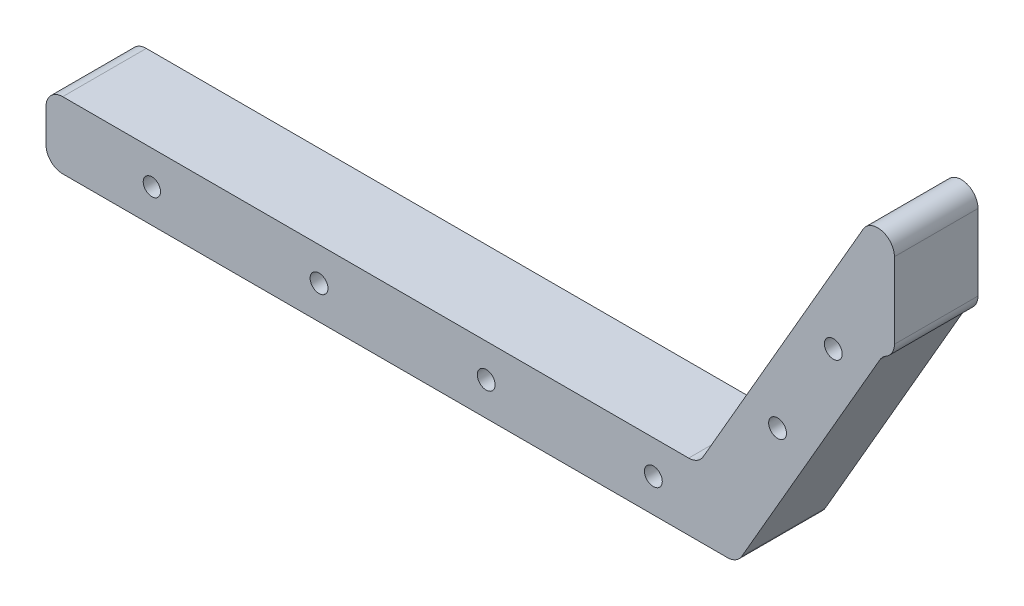
from build123d import *

# Parameters (mm, degrees)
SKETCH_2_R      = 1.6
EXTRUDE_1_DEPTH = 15
FILLET_1_R      = 3
SKETCH_3_W      = 45
SKETCH_3_H      = 12
SKETCH_3_R      = 1.55
EXTRUDE_2_DEPTH = 15
FILLET_2_R      = 3


with BuildPart() as part:
    # 草图2 → 凸台-拉伸1 (new body)
    with BuildSketch(Plane.XY):
        with BuildLine():
            Line((110.262395693, 45.951905284), (110.262395693, 72.951905284))
            Line((110.262395693, 72.951905284), (75.937822174, 13.5))
            ThreePointArc((75.937822174, 13.5), (74.839745962, 12.401923789), (73.339745962, 12))
            Line((73.339745962, 12), (0, 12))
            Line((0, 12), (0, 0))
            Line((0, 0), (80.267949192, 0))
            ThreePointArc((80.267949192, 0), (81.767949192, 0.401923789), (82.866025404, 1.5))
            Line((82.866025404, 1.5), (107.664319482, 44.451905284))
            ThreePointArc((107.664319482, 44.451905284), (108.762395693, 45.549981495), (110.262395693, 45.951905284))
        make_face()
        with Locations((99.292740578, 41.951905284)):
            Circle(SKETCH_2_R, mode=Mode.SUBTRACT)
        with Locations((89.292740578, 24.631397208)):
            Circle(SKETCH_2_R, mode=Mode.SUBTRACT)
        with Locations((67, 6)):
            Circle(SKETCH_2_R, mode=Mode.SUBTRACT)
        with Locations((37, 6)):
            Circle(SKETCH_2_R, mode=Mode.SUBTRACT)
        with Locations((7, 6)):
            Circle(SKETCH_2_R, mode=Mode.SUBTRACT)
    extrude(amount=EXTRUDE_1_DEPTH)

    # 圆角1
    fillet_1_edges = [part.edges().sort_by_distance(p)[0] for p in [
        (0, 0, 7.5),
        (0, 12, 7.5),
        (110.262395693, 72.951905284, 7.5),
        (110.262395693, 45.951905284, 7.5),
    ]]
    fillet(fillet_1_edges, radius=FILLET_1_R)

    # 草图3 → 凸台-拉伸2 (add)
    with BuildSketch(Plane.XY.offset(15)):
        with Locations((-19.5, 6)):
            Rectangle(SKETCH_3_W, SKETCH_3_H)
        with Locations((-23, 6)):
            Circle(SKETCH_3_R, mode=Mode.SUBTRACT)
    extrude(amount=-EXTRUDE_2_DEPTH)

    # 圆角2
    fillet_2_edges = [part.edges().sort_by_distance(p)[0] for p in [
        (-42, 0, 7.5),
        (-42, 12, 7.5),
    ]]
    fillet(fillet_2_edges, radius=FILLET_2_R)


solid = part.part
